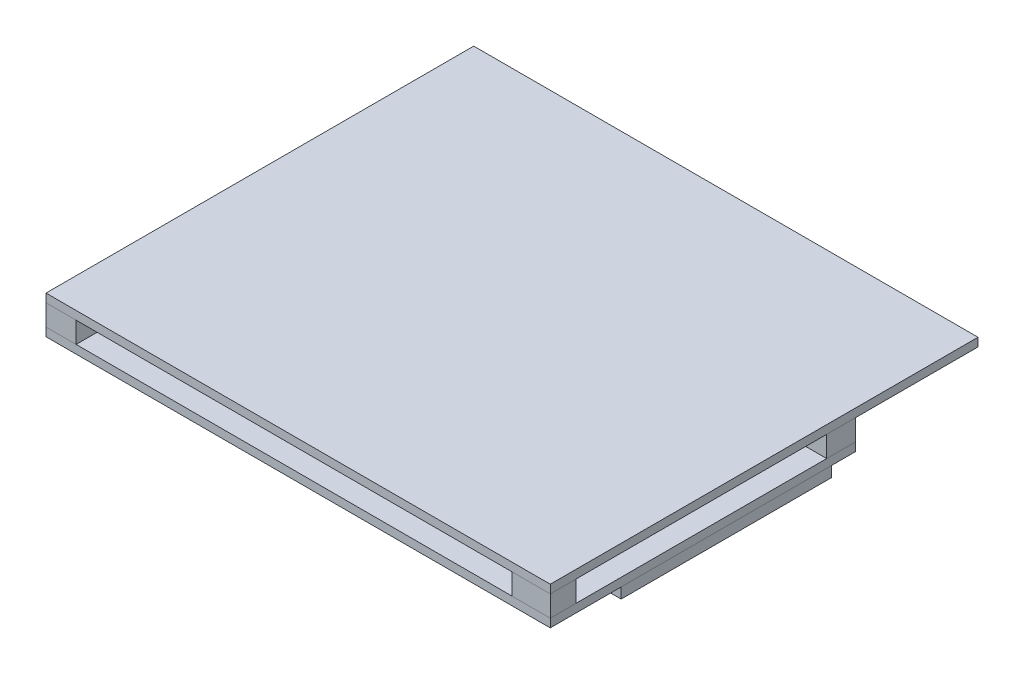
from build123d import *

# Parameters (mm, degrees)
SKETCH_1_W        = 95.933471424
SKETCH_1_H        = 58.037100116
EXTRUDE_1_DEPTH   = 1.6
SKETCH_2_W        = 7.677763417
SKETCH_2_H        = 5.44273959
EXTRUDE_2_DEPTH   = 4
SKETCH_2_W_2      = 5.728314019
SKETCH_2_H_2      = 5.920459935
EXTRUDE_2_2_DEPTH = 4
SKETCH_2_W_3      = 7.232783325
EXTRUDE_2_3_DEPTH = 4
SKETCH_2_H_3      = 4.886397559
EXTRUDE_2_4_DEPTH = 4
SKETCH_4_W        = 47.24386775
SKETCH_4_H        = 26.488980314
EXTRUDE_3_DEPTH   = 1.5
SKETCH_5_W        = 95.933471424
SKETCH_5_H        = 39.999042742
EXTRUDE_4_DEPTH   = 2
SKETCH_6_W        = 95.936200817
SKETCH_6_H        = 81.376254056
EXTRUDE_5_DEPTH   = 1.6
SKETCH_7_W        = 21.395648568
SKETCH_7_H        = 18.587106808
EXTRUDE_6_DEPTH   = 5
SKETCH_8_R        = 6.470047581
EXTRUDE_7_DEPTH   = 2


with BuildPart() as part:
    # 草图1 → 凸台-拉伸1 (new body)
    with BuildSketch(Plane(origin=(0, 0, 0), x_dir=(1, 0, 0), z_dir=(0, 1, 0))):
        Rectangle(SKETCH_1_W, SKETCH_1_H)
    extrude(amount=EXTRUDE_1_DEPTH)

    # 草图4 → 凸台-拉伸3 (add)
    with BuildSketch(Plane(origin=(0, 1.6, 0), x_dir=(1, 0, 0), z_dir=(0, 1, 0))):
        with Locations((-18.456617405, -0.323032298)):
            Rectangle(SKETCH_4_W, SKETCH_4_H)
    extrude(amount=EXTRUDE_3_DEPTH)


with BuildPart() as body_2:
    # 草图2 → 凸台-拉伸2 (new body)
    with BuildSketch(Plane(origin=(0, 1.6, 0), x_dir=(1, 0, 0), z_dir=(0, 1, 0))):
        with Locations((-44.127854004, 26.297180263)):
            Rectangle(SKETCH_2_W, SKETCH_2_H)
    extrude(amount=EXTRUDE_2_DEPTH)


with BuildPart() as body_3:
    # 草图2 → Extrude 2 2 (new body)
    with BuildSketch(Plane(origin=(0, 1.6, 0), x_dir=(1, 0, 0), z_dir=(0, 1, 0))):
        with Locations((-45.102578702, -26.058320091)):
            Rectangle(SKETCH_2_W_2, SKETCH_2_H_2)
    extrude(amount=EXTRUDE_2_2_DEPTH)


with BuildPart() as body_4:
    # 草图2 → Extrude 2 3 (new body)
    with BuildSketch(Plane(origin=(0, 1.6, 0), x_dir=(1, 0, 0), z_dir=(0, 1, 0))):
        with Locations((44.35034405, 26.297180263)):
            Rectangle(SKETCH_2_W_3, SKETCH_2_H)
    extrude(amount=EXTRUDE_2_3_DEPTH)


with BuildPart() as body_5:
    # 草图2 → Extrude 2 4 (new body)
    with BuildSketch(Plane(origin=(0, 1.6, 0), x_dir=(1, 0, 0), z_dir=(0, 1, 0))):
        with Locations((44.35034405, -26.575351279)):
            Rectangle(SKETCH_2_W_3, SKETCH_2_H_3)
    extrude(amount=EXTRUDE_2_4_DEPTH)


with BuildPart() as body_6:
    # 草图5 → 凸台-拉伸4 (new body)
    with BuildSketch(Plane.XZ):
        with Locations((0, -4.466732748)):
            Rectangle(SKETCH_5_W, SKETCH_5_H)
    extrude(amount=EXTRUDE_4_DEPTH)


with BuildPart() as body_7:
    # 草图6 → 凸台-拉伸5 (new body)
    with BuildSketch(Plane(origin=(0, 5.6, 0), x_dir=(1, 0, 0), z_dir=(0, 1, 0))):
        with Locations((0.001364697, 11.66957697)):
            Rectangle(SKETCH_6_W, SKETCH_6_H)
    extrude(amount=EXTRUDE_5_DEPTH)


with BuildPart() as body_8:
    # 草图7 → 凸台-拉伸6 (new body)
    with BuildSketch(Plane.XZ.offset(-5.6)):
        with Locations((0, -40.043215121)):
            Rectangle(SKETCH_7_W, SKETCH_7_H)
    extrude(amount=EXTRUDE_6_DEPTH)


with BuildPart() as body_9:
    # 草图8 → 凸台-拉伸7 (new body)
    with BuildSketch(Plane.XZ.offset(-0.6)):
        with Locations(Location((0, -40.095477716, 0), (0, 0, 270))):
            Circle(SKETCH_8_R)
    extrude(amount=EXTRUDE_7_DEPTH)


solid = Compound([part.part, body_2.part, body_3.part, body_4.part, body_5.part, body_6.part, body_7.part, body_8.part, body_9.part])
